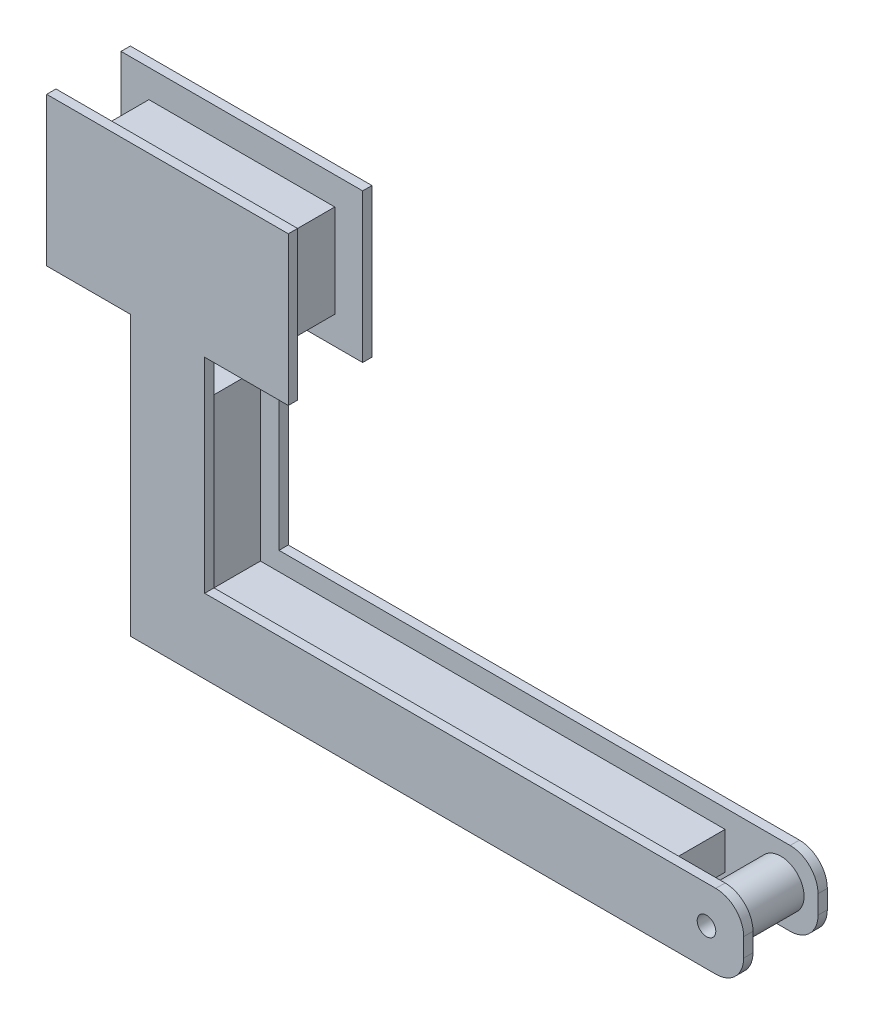
from build123d import *

# Parameters (mm, degrees)
SKETCH1_W           = 100
SKETCH1_H           = 50
BOSS_EXTRUDE1_DEPTH = 17.5
SKETCH2_R           = 5
BOSS_EXTRUDE2_DEPTH = 5
BOSS_EXTRUDE3_DEPTH = 17.5
FILLET1_R           = 15
SKETCH5_R           = 12.5
SKETCH5_R_2         = 5
BOSS_EXTRUDE4_DEPTH = 17.5


with BuildPart() as part:
    # Sketch1 → Boss-Extrude1 (new, symmetric)
    with BuildSketch(Plane.XY):
        Rectangle(SKETCH1_W, SKETCH1_H)
    extrude(amount=BOSS_EXTRUDE1_DEPTH, both=True)

    # Sketch2 → Boss-Extrude2 (add)
    with BuildSketch(Plane.XY.offset(17.5)):
        Polygon((20, -40), (65, -40), (65, 40), (-65, 40), (-65, -40), (-20, -40), (-20, -190), (20, -190), (270, -190), (310, -190), (310, -150), (270, -150), (20, -150), align=None)
        with Locations((290, -170)):
            Circle(SKETCH2_R, mode=Mode.SUBTRACT)
    boss_extrude2 = extrude(amount=BOSS_EXTRUDE2_DEPTH)

    # Mirror1: Boss-Extrude2 across plane
    add(boss_extrude2.mirror(Plane.XY))

    # Sketch4 → Boss-Extrude3 (add, symmetric)
    with BuildSketch(Plane.XY):
        Polygon((-10, -70), (-10, -180), (260, -180), (260, -160), (10, -160), (10, -70), align=None)
    extrude(amount=BOSS_EXTRUDE3_DEPTH, both=True)

    # Fillet1
    fillet1_edges = [part.edges().sort_by_distance(p)[0] for p in [
        (310, -190, -20),
        (310, -190, 20),
        (310, -150, -20),
        (310, -150, 20),
    ]]
    fillet(fillet1_edges, radius=FILLET1_R)

    # Sketch5 → Boss-Extrude4 (add, symmetric)
    with BuildSketch(Plane.XY):
        with Locations((290, -170)):
            Circle(SKETCH5_R)
        with Locations((290, -170)):
            Circle(SKETCH5_R_2, mode=Mode.SUBTRACT)
    extrude(amount=BOSS_EXTRUDE4_DEPTH, both=True)


solid = part.part
